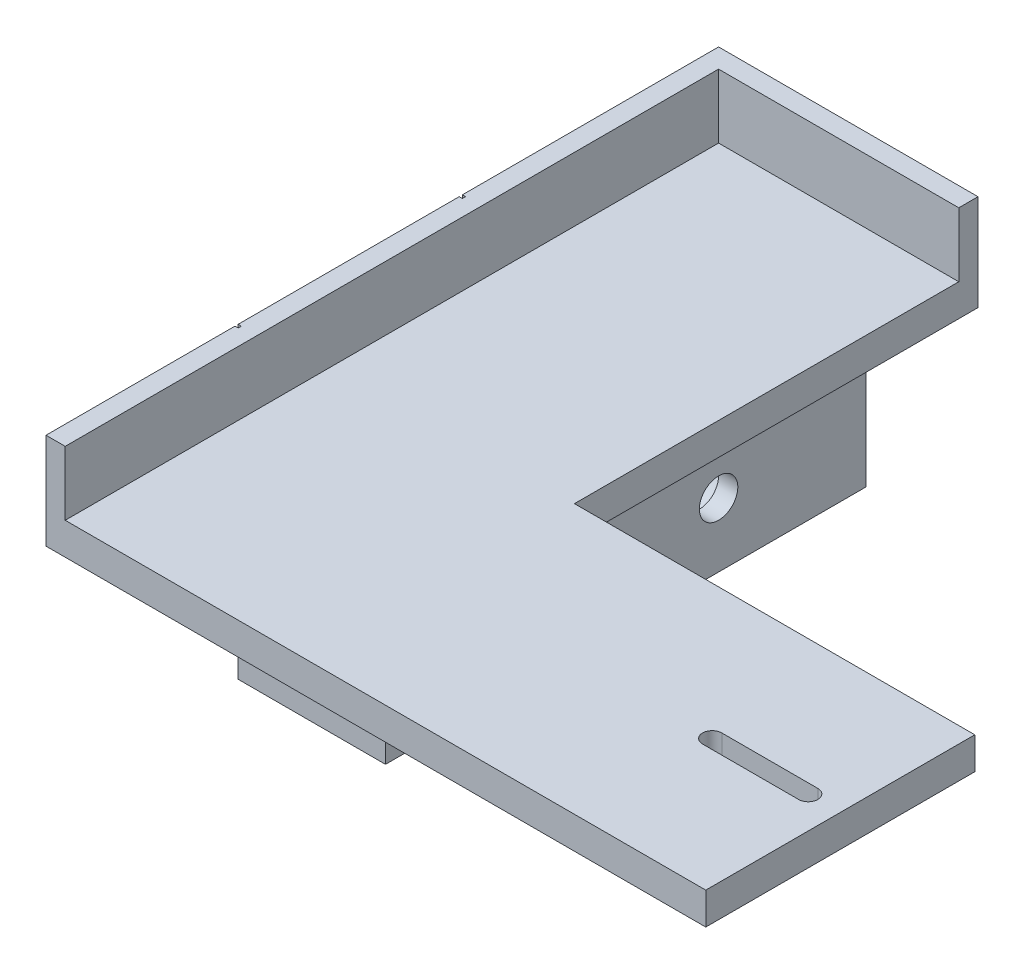
from build123d import *

# Parameters (mm, degrees)
EXTRUDE_1_DEPTH     = 5
SKETCH_2_W          = 20
SKETCH_2_H          = 72
EXTRUDE_2_DEPTH     = 33
SKETCH_3_R          = 3
CUT_EXTRUDE_1_DEPTH = 30
SKETCH_4_R          = 5
CUT_EXTRUDE_2_DEPTH = 17
EXTRUDE_START       = 3
SKETCH_5_R          = 5
EXTRUDE_3_DEPTH     = 3
EXTRUDE_4_DEPTH     = 3
EXTRUDE_5_DEPTH     = 10
SKETCH_8_W          = 42
SKETCH_8_H          = 5
EXTRUDE_6_DEPTH     = 25
CUT_EXTRUDE_3_DEPTH = 10
SKETCH_10_W         = 75
SKETCH_10_H         = 0.5
CUT_EXTRUDE_4_DEPTH = 0.5
SKETCH_11_W         = 0.5
SKETCH_11_H         = 15
SKETCH_11_H_2       = 48
CUT_EXTRUDE_5_DEPTH = 0.5


with BuildPart() as part:
    # 草图1 → 凸台-拉伸1 (new body)
    with BuildSketch(Plane(origin=(0, 0, 0), x_dir=(1, 0, 0), z_dir=(0, 1, 0))):
        Polygon((-37.5, 76), (-37.5, -26), (37.5, -26), (37.5, 16), (0, 16), (0, 76), align=None)
    extrude(amount=EXTRUDE_1_DEPTH)

    # 草图2 → 凸台-拉伸2 (add)
    with BuildSketch(Plane.XZ):
        with Locations((-27.5, -40)):
            Rectangle(SKETCH_2_W, SKETCH_2_H)
    extrude(amount=EXTRUDE_2_DEPTH)

    # 草图3 → 切除-拉伸1 (cut)
    with BuildSketch(Plane.ZY.offset(37.5)):
        with Locations((-56, -23)):
            Circle(SKETCH_3_R)
        with Locations((-24, -23)):
            Circle(SKETCH_3_R)
    extrude(amount=-CUT_EXTRUDE_1_DEPTH, mode=Mode.SUBTRACT)

    # 草图4 → 切除-拉伸2 (cut)
    with BuildSketch(Plane.ZY.offset(37.5)):
        with Locations((-56, -23)):
            Circle(SKETCH_4_R)
        with Locations((-24, -23)):
            Circle(SKETCH_4_R)
    extrude(amount=-CUT_EXTRUDE_2_DEPTH, mode=Mode.SUBTRACT)

    # 草图5 → 凸台-拉伸3 (add)
    with BuildSketch(Plane.ZY.offset(37.5).offset(EXTRUDE_START)):
        Polygon((-76, 5), (26, 5), (26, 0), (-4, 0), (-4, -33), (-76, -33), align=None)
        with Locations((-56, -23)):
            Circle(SKETCH_5_R, mode=Mode.SUBTRACT)
        with Locations((-24, -23)):
            Circle(SKETCH_5_R, mode=Mode.SUBTRACT)
    extrude(amount=-EXTRUDE_3_DEPTH)

    # 草图6 → 凸台-拉伸4 (add)
    with BuildSketch(Plane(origin=(0, 0, -76), x_dir=(-1, 0, 0), z_dir=(0, 0, -1))):
        Polygon((0, 5), (0, 0), (17.5, 0), (17.5, -33), (40.5, -33), (40.5, 5), align=None)
    extrude(amount=EXTRUDE_4_DEPTH)

    # 草图7 → 凸台-拉伸5 (add)
    with BuildSketch(Plane(origin=(0, 5, 0), x_dir=(1, 0, 0), z_dir=(0, 1, 0))):
        Polygon((0, 76), (0, 79), (-40.5, 79), (-40.5, -26), (-37.5, -26), (-37.5, 76), align=None)
    extrude(amount=EXTRUDE_5_DEPTH)

    # 草图8 → 凸台-拉伸6 (add)
    with BuildSketch(Plane(origin=(37.5, 0, 0), x_dir=(0, 0, -1), z_dir=(1, 0, 0))):
        with Locations((-5, 2.5)):
            Rectangle(SKETCH_8_W, SKETCH_8_H)
    extrude(amount=EXTRUDE_6_DEPTH)

    # 草图9 → 切除-拉伸3 (cut)
    with BuildSketch(Plane(origin=(0, 5, 0), x_dir=(1, 0, 0), z_dir=(0, 1, 0))):
        with BuildLine():
            Line((57.5, -3.5), (42.5, -3.5))
            ThreePointArc((42.5, -3.5), (41, -5), (42.5, -6.5))
            Line((42.5, -6.5), (57.5, -6.5))
            ThreePointArc((57.5, -6.5), (59, -5), (57.5, -3.5))
        make_face()
    extrude(amount=-CUT_EXTRUDE_3_DEPTH, mode=Mode.SUBTRACT)

    # 草图10 → 切除-拉伸4 (cut)
    with BuildSketch(Plane.ZY.offset(40.5)):
        with Locations((-41.5, -0.25)):
            Rectangle(SKETCH_10_W, SKETCH_10_H)
    extrude(amount=-CUT_EXTRUDE_4_DEPTH, mode=Mode.SUBTRACT)

    # 草图11 → 切除-拉伸5 (cut)
    with BuildSketch(Plane.ZY.offset(40.5)):
        with Locations((-3.75, 7.5)):
            Rectangle(SKETCH_11_W, SKETCH_11_H)
        with Locations((-38.75, -9)):
            Rectangle(SKETCH_11_W, SKETCH_11_H_2)
    extrude(amount=-CUT_EXTRUDE_5_DEPTH, mode=Mode.SUBTRACT)


solid = part.part
